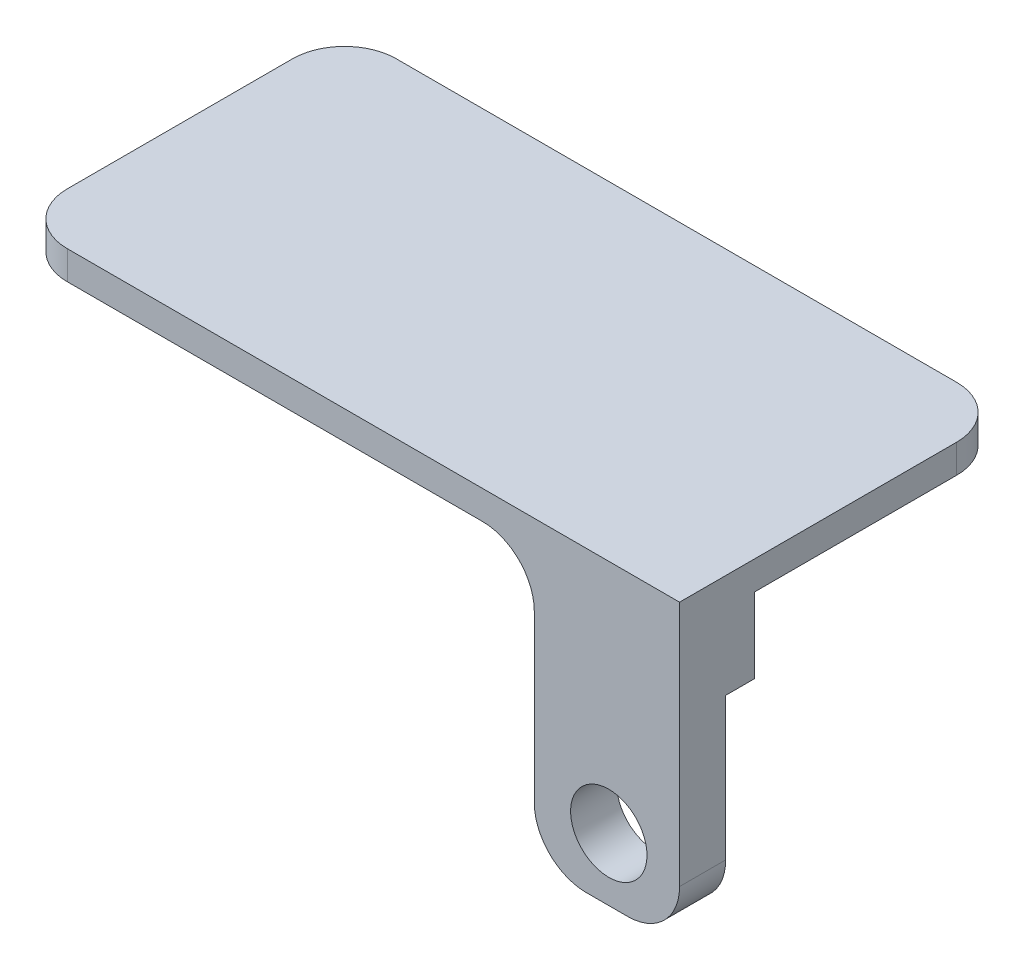
from build123d import *

# Parameters (mm, degrees)
BOSS_EXTRUDE6_DEPTH = 14
SKETCH8_R           = 3.68
CUT_EXTRUDE1_DEPTH  = 10
SKETCH10_W          = 31.702507637
SKETCH10_H          = 2.761891862
BOSS_EXTRUDE8_DEPTH = 50
FILLET2_R           = 5


with BuildPart() as part:
    # Sketch7 → Boss-Extrude6 (new body)
    with BuildSketch(Plane(origin=(0, 0, 44.491647423), x_dir=(0, 1, 0), z_dir=(1, 0, 0))):
        Polygon((57.244330768, -80.05237461), (75.978257712, -80.05237461), (75.978257712, -82.841498661), (83.21636585, -82.841498661), (83.21636585, -107.310582048), (85.978257712, -107.310582048), (85.978257712, -75.608074412), (57.244330768, -75.608074412), align=None)
    extrude(amount=-BOSS_EXTRUDE6_DEPTH)

    # Sketch8 → Cut-Extrude1 (cut)
    with BuildSketch(Plane.XY.offset(-31.116426988)):
        with Locations((-6.819274641, 63.278257712)):
            Circle(SKETCH8_R)
    extrude(amount=-CUT_EXTRUDE1_DEPTH, mode=Mode.SUBTRACT)

    # Sketch10 → Boss-Extrude8 (add)
    with BuildSketch(Plane.ZY.offset(14)):
        with Locations((-46.967680806, 84.597311781)):
            Rectangle(SKETCH10_W, SKETCH10_H)
    extrude(amount=BOSS_EXTRUDE8_DEPTH)

    # Fillet2
    fillet2_edges = [part.edges().sort_by_distance(p)[0] for p in [
        (-64, 84.597311781, -62.818934625),
        (0, 84.597311781, -62.818934625),
        (0, 57.244330768, -33.338577087),
        (-14, 57.244330768, -33.338577087),
        (-64, 84.597311781, -31.116426988),
        (-14, 83.21636585, -34.733139113),
    ]]
    fillet(fillet2_edges, radius=FILLET2_R)


solid = part.part
